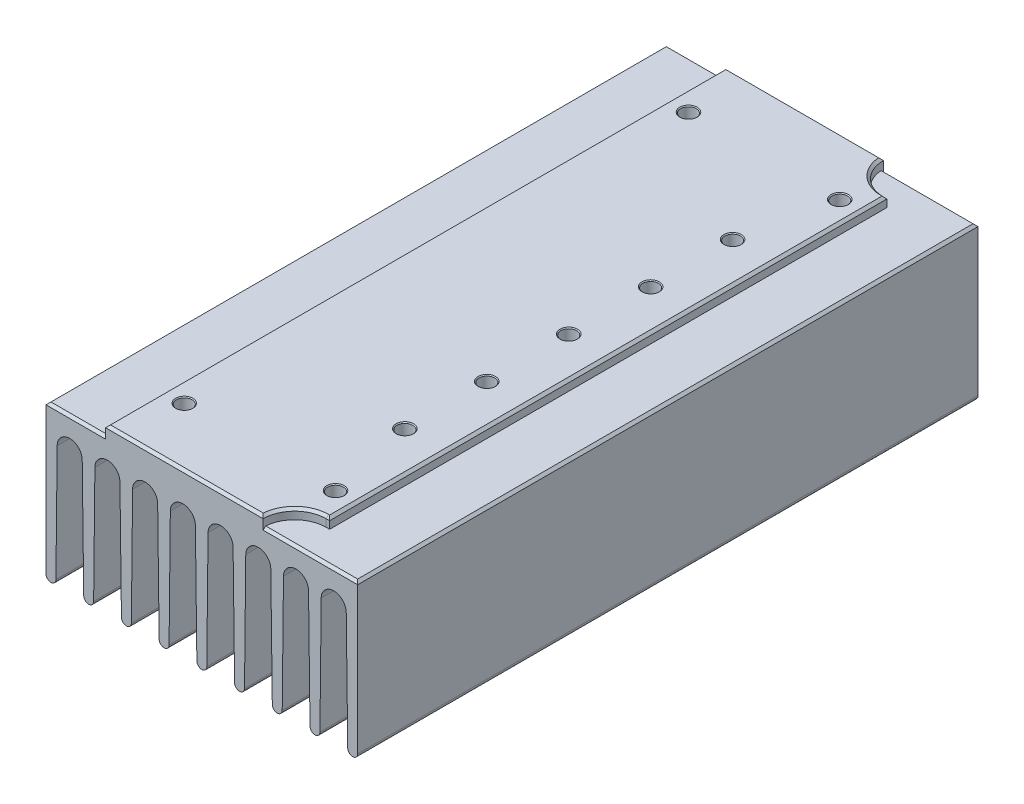
from build123d import *

# Parameters (mm, degrees)
EXTRUDE_1_DEPTH             = 62.5
HOLE_WIZARD_M31_D           = 3.15
HOLE_WIZARD_M31_DEPTH       = 10
HOLE_WIZARD_M31_CSINK_D     = 3.5
HOLE_WIZARD_M31_CSINK_ANGLE = 90
HOLE_WIZARD_M31_TIP         = 0.946355475
CUT_EXTRUDE_2_DEPTH         = 2
CHAMFER_1_SIZE              = 0.5


with BuildPart() as part:
    # Эскиз1 → Бобышка-Вытянуть1 (new, symmetric)
    with BuildSketch(Plane.XY):
        with BuildLine():
            Line((-19.4, 0), (19.4, 0))
            Line((19.4, 0), (19.4, -2))
            Line((19.4, -2), (31.4, -2))
            Line((31.4, -2), (31.4, -6.000517486))
            Line((31.4, -6.000517486), (31.4, -32))
            ThreePointArc((31.4, -32), (30.406376534, -32.99997967), (29.40008132, -32.012752808))
            Line((29.40008132, -32.012752808), (29.099793084, -8.467834553))
            ThreePointArc((29.099793084, -8.467834553), (26.573234779, -5.975854204), (24.051798919, -8.473017422))
            Line((24.051798919, -8.473017422), (23.799942759, -32.010699513))
            ThreePointArc((23.799942759, -32.010699513), (22.801026718, -32.999999473), (21.80008132, -32.012752808))
            Line((21.80008132, -32.012752808), (21.499793084, -8.467834553))
            ThreePointArc((21.499793084, -8.467834553), (18.973234779, -5.975854204), (16.451798919, -8.473017422))
            Line((16.451798919, -8.473017422), (16.199942759, -32.010699513))
            ThreePointArc((16.199942759, -32.010699513), (15.201026718, -32.999999473), (14.20008132, -32.012752808))
            Line((14.20008132, -32.012752808), (13.899793084, -8.467834553))
            ThreePointArc((13.899793084, -8.467834553), (11.373234779, -5.975854204), (8.851798919, -8.473017422))
            Line((8.851798919, -8.473017422), (8.599942759, -32.010699513))
            ThreePointArc((8.599942759, -32.010699513), (7.601026718, -32.999999473), (6.60008132, -32.012752808))
            Line((6.60008132, -32.012752808), (6.299793084, -8.467834553))
            ThreePointArc((6.299793084, -8.467834553), (3.773234779, -5.975854204), (1.251798919, -8.473017422))
            Line((1.251798919, -8.473017422), (0.999942759, -32.010699513))
            ThreePointArc((0.999942759, -32.010699513), (0.001026718, -32.999999473), (-0.99991868, -32.012752808))
            Line((-0.99991868, -32.012752808), (-1.300206916, -8.467834553))
            ThreePointArc((-1.300206916, -8.467834553), (-3.826765221, -5.975854204), (-6.348201081, -8.473017422))
            Line((-6.348201081, -8.473017422), (-6.600057241, -32.010699513))
            ThreePointArc((-6.600057241, -32.010699513), (-7.598973282, -32.999999473), (-8.59991868, -32.012752808))
            Line((-8.59991868, -32.012752808), (-8.900206916, -8.467834553))
            ThreePointArc((-8.900206916, -8.467834553), (-11.426765221, -5.975854204), (-13.948201081, -8.473017422))
            Line((-13.948201081, -8.473017422), (-14.200057241, -32.010699513))
            ThreePointArc((-14.200057241, -32.010699513), (-15.198973282, -32.999999473), (-16.19991868, -32.012752808))
            Line((-16.19991868, -32.012752808), (-16.500206916, -8.467834553))
            ThreePointArc((-16.500206916, -8.467834553), (-19.026765221, -5.975854204), (-21.548201081, -8.473017422))
            Line((-21.548201081, -8.473017422), (-21.800057241, -32.010699513))
            ThreePointArc((-21.800057241, -32.010699513), (-22.798973282, -32.999999473), (-23.79991868, -32.012752808))
            Line((-23.79991868, -32.012752808), (-24.100206916, -8.467834553))
            ThreePointArc((-24.100206916, -8.467834553), (-26.626765221, -5.975854204), (-29.148201081, -8.473017422))
            Line((-29.148201081, -8.473017422), (-29.400057241, -32.010699513))
            ThreePointArc((-29.400057241, -32.010699513), (-30.405349833, -32.99998569), (-31.4, -32))
            Line((-31.4, -32), (-31.4, -6.000517486))
            Line((-31.4, -6.000517486), (-31.4, -2))
            Line((-31.4, -2), (-19.4, -2))
            Line((-19.4, -2), (-19.4, 0))
        make_face()
    extrude(amount=EXTRUDE_1_DEPTH, both=True)

    # Сверло под метчик  спиральное M31
    with Locations(Plane(origin=(0, 0, 0), x_dir=(1, 0, 0), z_dir=(0, 1, 0))):
        with Locations((11.43, 0), (11.43, -16.51), (11.43, -33.02), (11.43, 16.51), (11.43, 33.02), (15.24, 50.8), (-15.24, 50.8), (-15.24, -50.8), (15.24, -50.8)):
            CounterSinkHole(HOLE_WIZARD_M31_D / 2, HOLE_WIZARD_M31_CSINK_D / 2, depth=HOLE_WIZARD_M31_DEPTH, counter_sink_angle=HOLE_WIZARD_M31_CSINK_ANGLE)
            with Locations((0, 0, -(HOLE_WIZARD_M31_DEPTH + HOLE_WIZARD_M31_TIP / 2))):  # 118° drill point
                Cone(0, HOLE_WIZARD_M31_D / 2, HOLE_WIZARD_M31_TIP, mode=Mode.SUBTRACT)

    # Эскиз6 → Вырез-Вытянуть2 (cut)
    with BuildSketch(Plane(origin=(0, 0, 0), x_dir=(1, 0, 0), z_dir=(0, 1, 0))):
        with BuildLine():
            Line((18.7, 62.5), (31.4, 62.5))
            Line((31.4, 62.5), (31.4, 56.15))
            Line((31.4, 56.15), (18.7, 56.15))
            ThreePointArc((18.7, 56.15), (14.209871939, 58.009871939), (12.35, 62.5))
            Line((12.35, 62.5), (18.7, 62.5))
        make_face()
        with BuildLine():
            Line((12.35, -62.5), (18.7, -62.5))
            Line((18.7, -62.5), (31.4, -62.5))
            Line((31.4, -62.5), (31.4, -56.15))
            Line((31.4, -56.15), (18.7, -56.15))
            ThreePointArc((18.7, -56.15), (14.209871939, -58.009871939), (12.35, -62.5))
        make_face()
    extrude(amount=-CUT_EXTRUDE_2_DEPTH, mode=Mode.SUBTRACT)

    # Фаска1
    chamfer_1_edges = [part.edges().sort_by_distance(p)[0] for p in [
        (21.875, -2, -62.5),
        (-3.525, 0, 62.5),
        (-3.525, 0, -62.5),
        (19.4, 0, 0),
        (19.05, 0, -56.15),
        (14.209871939, 0, -58.009871939),
        (19.05, 0, 56.15),
        (14.209871939, 0, 58.009871939),
        (21.875, -2, 62.5),
        (-25.4, -2, -62.5),
        (-25.4, -2, 62.5),
        (-19.4, 0, 0),
        (31.4, -2, 0),
        (-31.4, -2, 0),
    ]]
    chamfer(chamfer_1_edges, length=CHAMFER_1_SIZE)


solid = part.part
